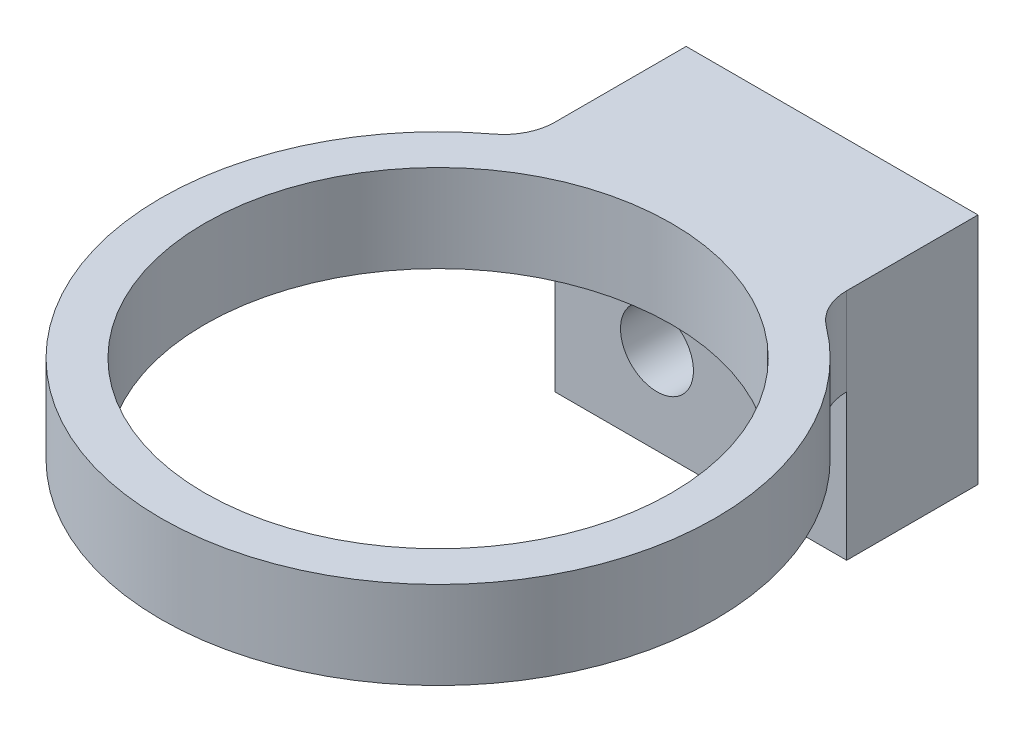
from build123d import *

# Parameters (mm, degrees)
BOSS_EXTRUDE1_DEPTH       = 3
SKETCH2_W                 = 10
SKETCH2_H                 = 4.5
BOSS_EXTRUDE2_DEPTH       = 5
M2X0_4_TAPPED_HOLE1_D     = 1.6
M2X0_4_TAPPED_HOLE1_DEPTH = 5.2
M2X0_4_TAPPED_HOLE1_TIP   = 0.480688495
M3X0_5_TAPPED_HOLE1_D     = 2.5
M14_CLEARANCE_HOLE1_D     = 16
FILLET1_R                 = 1.749999932


with BuildPart() as part:
    # Sketch1 → Boss-Extrude1 (new body)
    with BuildSketch(Plane.XZ):
        with BuildLine():
            Line((-5, 5.422252789), (-5, 0))
            Line((-5, 0), (5, 0))
            Line((5, 0), (5, 5.422252789))
            ThreePointArc((5, 5.422252789), (0, 23), (-5, 5.422252789))
        make_face()
    extrude(amount=-BOSS_EXTRUDE1_DEPTH)

    # Sketch2 → Boss-Extrude2 (add)
    with BuildSketch(Plane.XZ):
        with Locations((0, 2.25)):
            Rectangle(SKETCH2_W, SKETCH2_H)
    extrude(amount=BOSS_EXTRUDE2_DEPTH)

    # M2x0.4 Tapped Hole1
    with Locations(Plane(origin=(0, 0, 0), x_dir=(-1, 0, 0), z_dir=(0, 0, -1))):
        with Locations((-3, 1)):
            Hole(M2X0_4_TAPPED_HOLE1_D / 2, depth=M2X0_4_TAPPED_HOLE1_DEPTH)
            with Locations((0, 0, -(M2X0_4_TAPPED_HOLE1_DEPTH + M2X0_4_TAPPED_HOLE1_TIP / 2))):  # 118° drill point
                Cone(0, M2X0_4_TAPPED_HOLE1_D / 2, M2X0_4_TAPPED_HOLE1_TIP, mode=Mode.SUBTRACT)

    # M3x0.5 Tapped Hole1 (through all)
    with Locations(Plane.XY.offset(4.5)):
        with Locations((-1.5, -2)):
            Hole(M3X0_5_TAPPED_HOLE1_D / 2)

    # M14 Clearance Hole1 (through all)
    with Locations(Plane(origin=(0, 0, 0), x_dir=(-1, 0, 0), z_dir=(0, -1, 0))):
        with Locations((0, -13.5)):
            Hole(M14_CLEARANCE_HOLE1_D / 2)

    # Fillet1
    fillet1_edges = [part.edges().sort_by_distance(p)[0] for p in [
        (-5, 1.5, 5.422252789),
        (5, 1.5, 5.422252789),
    ]]
    fillet(fillet1_edges, radius=FILLET1_R)


solid = part.part
